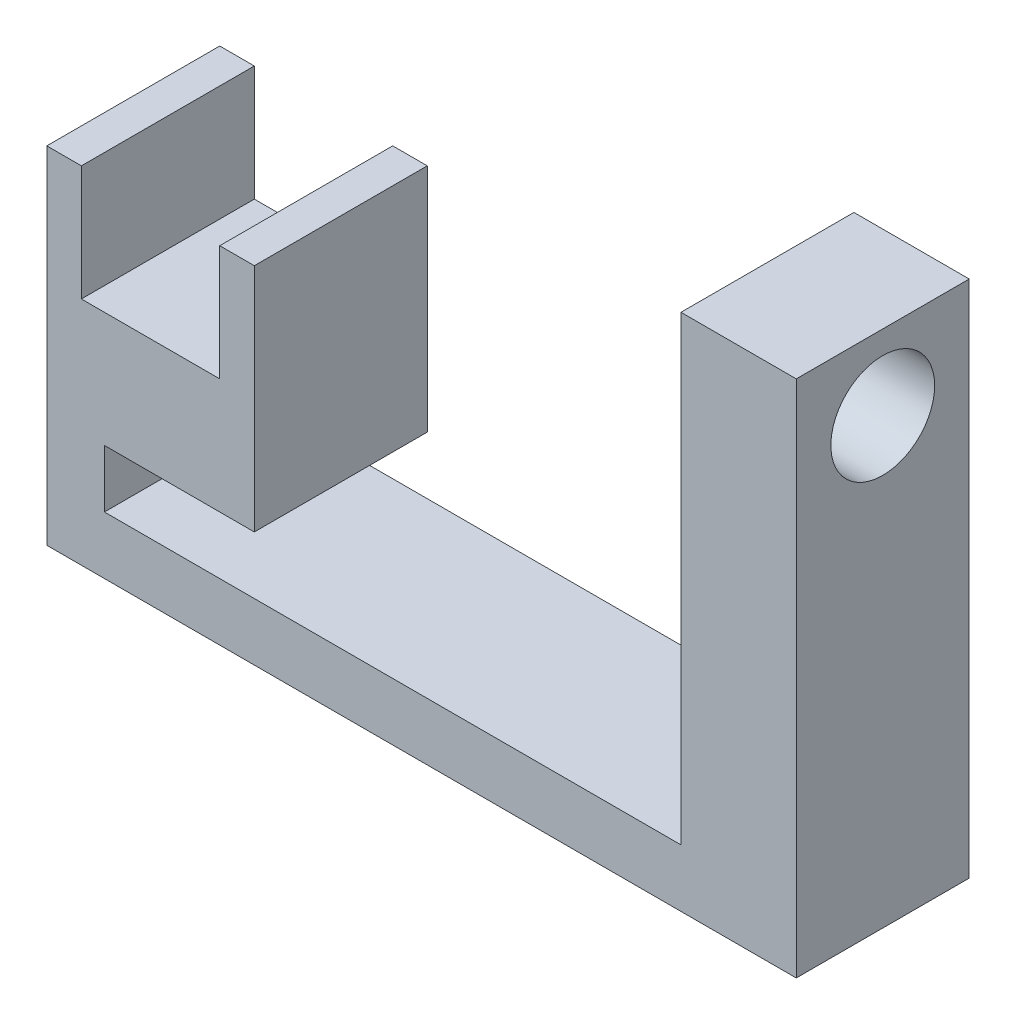
from build123d import *

# Parameters (mm, degrees)
EXTRUDE_1_DEPTH     = 15
SKETCH_5_R          = 4.5
CUT_EXTRUDE_1_DEPTH = 15


with BuildPart() as part:
    # Эскиз4 → Бобышка-Вытянуть1 (new body)
    with BuildSketch(Plane.XY):
        Polygon((0, 0), (0, -20), (0, -30), (65, -30), (65, 15), (55, 15), (55, -25), (5, -25), (5, -20), (18, -20), (18, 0), (15, 0), (15, -10), (3, -10), (3, 0), align=None)
    extrude(amount=EXTRUDE_1_DEPTH)

    # Эскиз5 → Вырез-Вытянуть1 (cut)
    with BuildSketch(Plane(origin=(65, 0, 0), x_dir=(0, 0, -1), z_dir=(1, 0, 0))):
        with Locations((-7.5, 8.5)):
            Circle(SKETCH_5_R)
    extrude(amount=-CUT_EXTRUDE_1_DEPTH, mode=Mode.SUBTRACT)


solid = part.part
